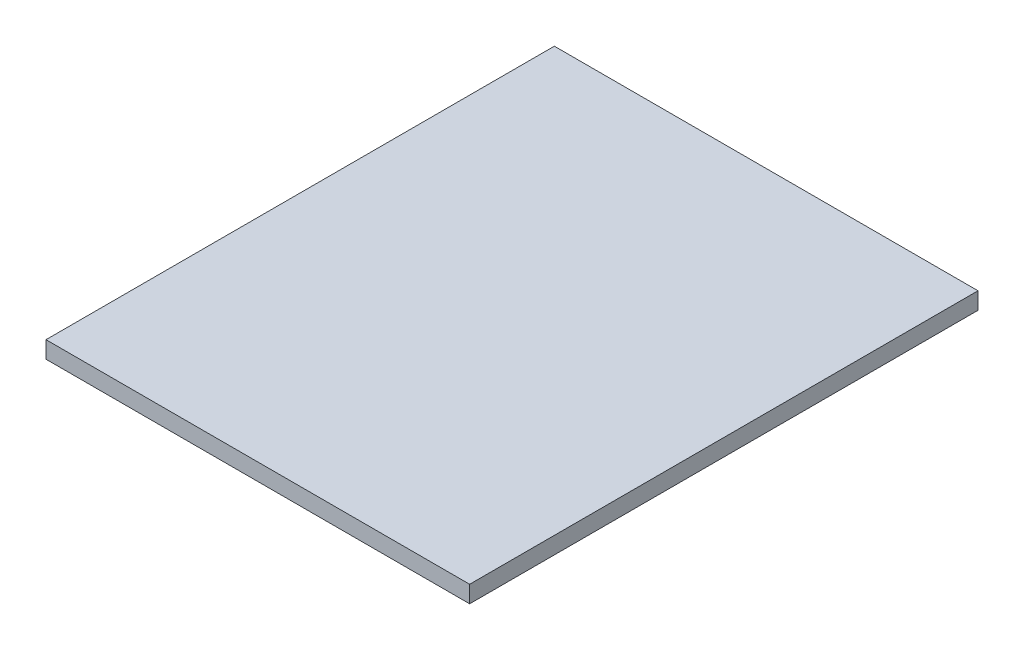
from build123d import *

# Parameters (mm, degrees)
SKETCH1_W           = 250
SKETCH1_H           = 300
BOSS_EXTRUDE1_DEPTH = 10


with BuildPart() as part:
    # Sketch1 → Boss-Extrude1 (new body)
    with BuildSketch(Plane(origin=(0, 0, 0), x_dir=(1, 0, 0), z_dir=(0, 1, 0))):
        Rectangle(SKETCH1_W, SKETCH1_H)
    extrude(amount=BOSS_EXTRUDE1_DEPTH)


solid = part.part
